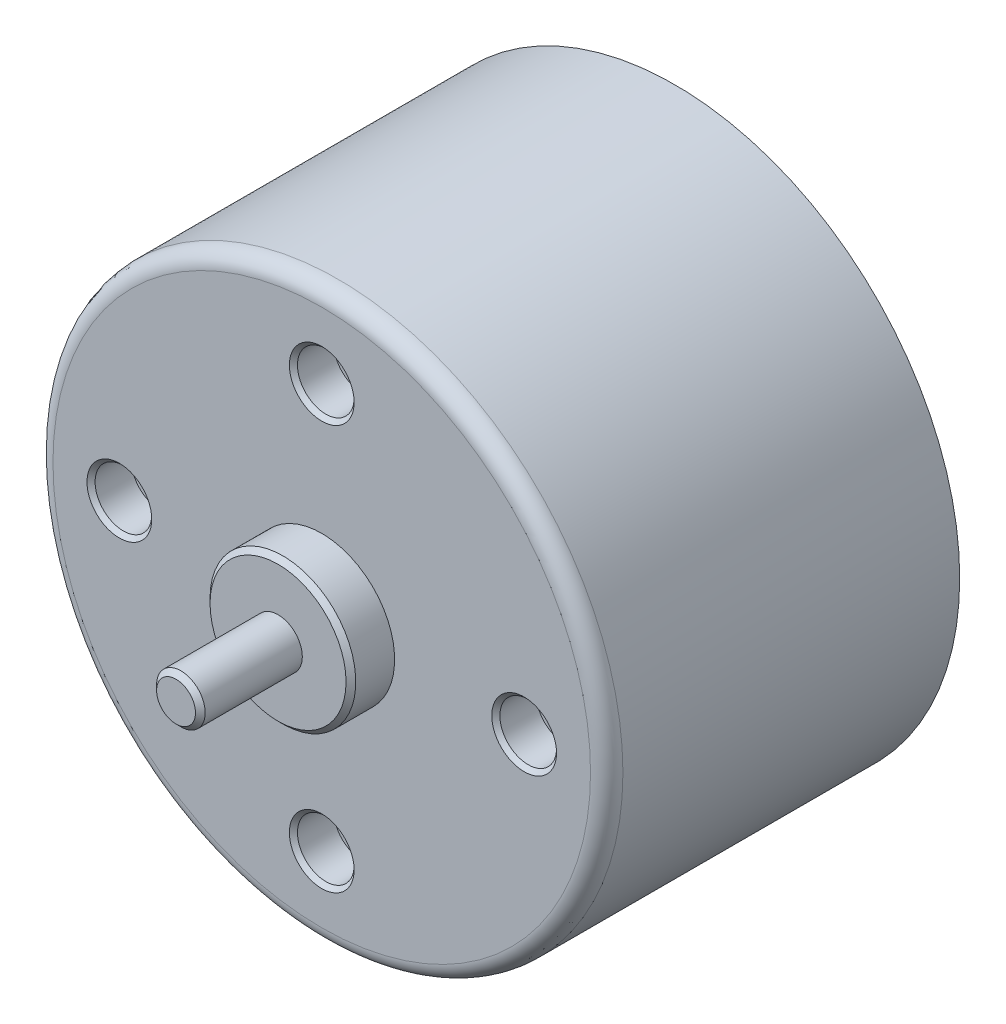
from build123d import *

# Parameters (mm, degrees)
SKETCH1_R           = 17.6
BOSS_EXTRUDE1_DEPTH = 21.8
SKETCH2_R           = 4.5
BOSS_EXTRUDE2_DEPTH = 2.7
SKETCH3_R           = 1.5
BOSS_EXTRUDE3_DEPTH = 6.3
BOSS_EXTRUDE4_START = 2.7
SKETCH4_R           = 4.5
BOSS_EXTRUDE4_DEPTH = 2.7
BOSS_EXTRUDE5_START = 2.5
SKETCH5_R           = 1.5
BOSS_EXTRUDE5_DEPTH = 2.5
SKETCH6_R           = 1.75
CUT_EXTRUDE1_DEPTH  = 2.5
CHAMFER1_SIZE       = 0.25
CHAMFER2_SIZE       = 0.3
FILLET1_R           = 1
CHAMFER3_SIZE       = 0.3


with BuildPart() as part:
    # Sketch1 → Boss-Extrude1 (new body)
    with BuildSketch(Plane.XY):
        Circle(SKETCH1_R)
    extrude(amount=BOSS_EXTRUDE1_DEPTH)

    # Sketch2 → Boss-Extrude2 (add)
    with BuildSketch(Plane.XY.offset(21.8)):
        with Locations(Location((0, 0, 0), (0, 0, 180))):
            Circle(SKETCH2_R)
    extrude(amount=BOSS_EXTRUDE2_DEPTH)

    # Sketch3 → Boss-Extrude3 (add)
    with BuildSketch(Plane.XY.offset(24.5)):
        Circle(SKETCH3_R)
    extrude(amount=BOSS_EXTRUDE3_DEPTH)

    # Sketch4 → Boss-Extrude4 (add)
    with BuildSketch(Plane(origin=(0, 0, 0), x_dir=(-1, 0, 0), z_dir=(0, 0, -1)).offset(BOSS_EXTRUDE4_START)):
        Circle(SKETCH4_R)
    extrude(amount=-BOSS_EXTRUDE4_DEPTH)

    # Sketch5 → Boss-Extrude5 (add)
    with BuildSketch(Plane(origin=(0, 0, -2.7), x_dir=(-1, 0, 0), z_dir=(0, 0, -1)).offset(BOSS_EXTRUDE5_START)):
        with Locations(Location((0, 0, 0), (0, 0, 180))):
            Circle(SKETCH5_R)
    extrude(amount=-BOSS_EXTRUDE5_DEPTH)

    # Sketch6 → Cut-Extrude1 (cut)
    with BuildSketch(Plane.XY.offset(21.8)):
        with Locations((0, 12.5)):
            Circle(SKETCH6_R)
        with Locations((12.5, 0)):
            Circle(SKETCH6_R)
        with Locations((0, -12.5)):
            Circle(SKETCH6_R)
        with Locations((-12.5, 0)):
            Circle(SKETCH6_R)
    extrude(amount=-CUT_EXTRUDE1_DEPTH, mode=Mode.SUBTRACT)

    # Chamfer1
    chamfer1_edges = [part.edges().sort_by_distance(p)[0] for p in [
        (-1.75, 12.5, 21.8),
        (10.75, 0, 21.8),
        (-1.75, -12.5, 21.8),
        (-14.25, 0, 21.8),
    ]]
    chamfer(chamfer1_edges, length=CHAMFER1_SIZE)

    # Chamfer2
    chamfer2_edges = [part.edges().sort_by_distance(p)[0] for p in [
        (4.5, 0, -2.7),
        (4.5, 0, 24.5),
    ]]
    chamfer(chamfer2_edges, length=CHAMFER2_SIZE)

    # Fillet1
    fillet1_edges = [part.edges().sort_by_distance(p)[0] for p in [
        (-17.6, 0, 21.8),
    ]]
    fillet(fillet1_edges, radius=FILLET1_R)

    # Chamfer3
    chamfer3_edges = [part.edges().sort_by_distance(p)[0] for p in [
        (-1.5, 0, 30.8),
        (-1.5, 0, -5.2),
    ]]
    chamfer(chamfer3_edges, length=CHAMFER3_SIZE)


solid = part.part
